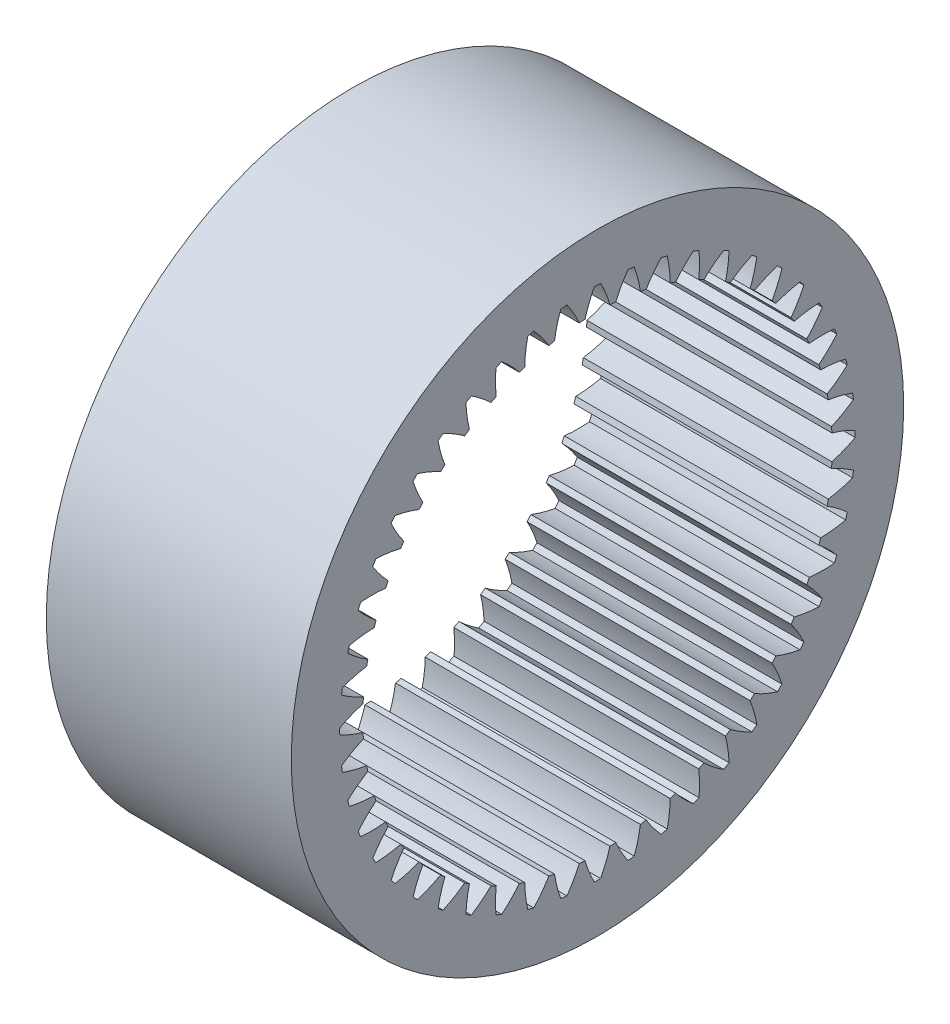
from build123d import *

# Parameters (mm, degrees)
BASPROSKE_W     = 12
BASPROSKE_H     = 3.5
TOOTHCUT_DEPTH  = 25.372115214
TEETHCUTS_COUNT = 48
TEETHCUTS_ANGLE = 352.5


with BuildPart() as part:
    # BasProSke → Base-Revolve (revolve)
    with BuildSketch(Plane(origin=(0, 0, 0), x_dir=(1, 0, 0), z_dir=(0, 1, 0)), mode=Mode.PRIVATE) as base_revolve_sk:
        with Locations((6, 13.25)):
            Rectangle(BASPROSKE_W, BASPROSKE_H)
    revolve(base_revolve_sk.sketch.rotate(Axis((-10, 0, 0), (1, 0, 0)), 180), axis=Axis((-10, 0, 0), (1, 0, 0)))

    # TooCutSke → ToothCut (cut, through all)
    with BuildSketch(Plane(origin=(0, 0, 0), x_dir=(0, 0, -1), z_dir=(1, 0, 0))):
        with BuildLine():
            ThreePointArc((0.617833873, 11.457954724), (0.415895108, 12.053724398), (0.152689292, 12.625076712))
            ThreePointArc((0.152689292, 12.625076712), (0, 12.626), (-0.152689292, 12.625076712))
            ThreePointArc((-0.152689292, 12.625076712), (-0.415895108, 12.053724398), (-0.617833873, 11.457954724))
            ThreePointArc((-0.617833873, 11.457954724), (0, 11.4746), (0.617833873, 11.457954724))
        make_face()
    toothcut = extrude(amount=TOOTHCUT_DEPTH, mode=Mode.SUBTRACT)

    # TeethCuts: ToothCut ×48 about axis
    teethcuts_axis = Axis((-10, 0, 0), (1, 0, 0))
    for i in range(1, TEETHCUTS_COUNT):
        add(toothcut.rotate(teethcuts_axis, i * TEETHCUTS_ANGLE / (TEETHCUTS_COUNT - 1)), mode=Mode.SUBTRACT)


solid = part.part
